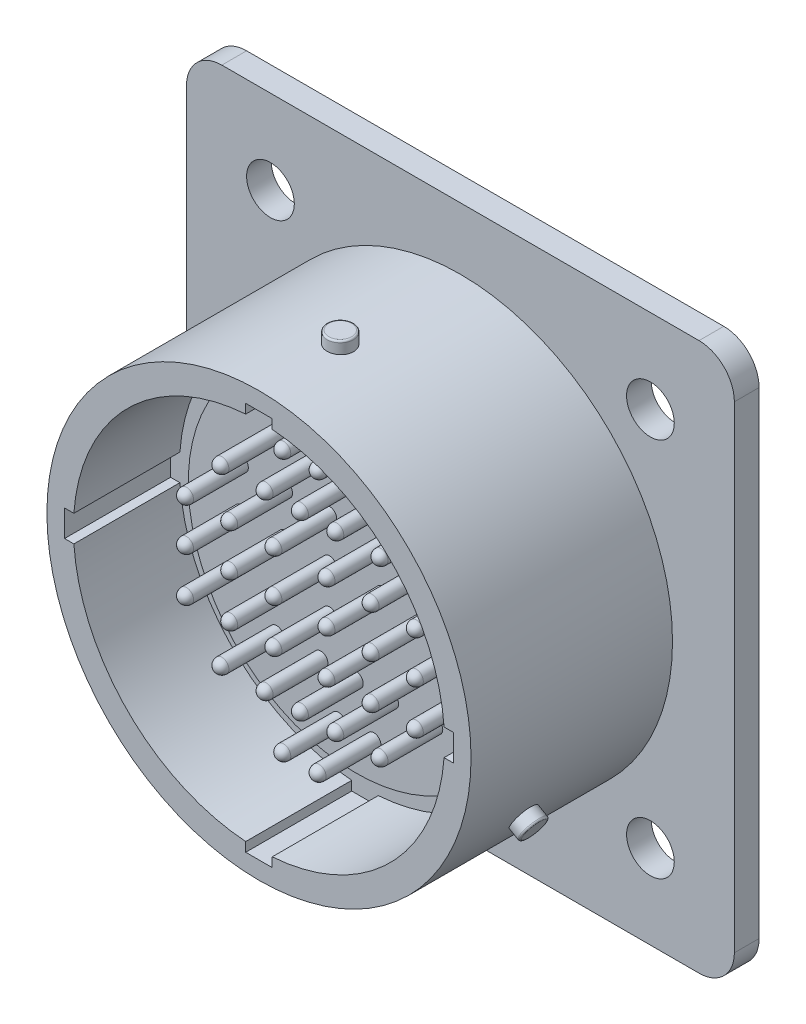
from build123d import *

# Parameters (mm, degrees)
SKETCH_1_W               = 31
SKETCH_1_H               = 31
EXTRUDE_1_DEPTH          = 0.7
SKETCH_2_R               = 1.35
CUT_EXTRUDE_1_DEPTH      = 3.4
SKETCH_4_R               = 11
EXTRUDE_2_DEPTH          = 1.6
SKETCH_5_R               = 12
EXTRUDE_3_DEPTH          = 11.4
FILLET_1_R               = 2
CUT_EXTRUDE_5_DEPTH      = 6
SKETCH_12_R              = 9.5
EXTRUDE_5_DEPTH          = 0.5
SKETCH_13_R              = 0.4
EXTRUDE_6_DEPTH          = 3.5
PATTERN_CIRCULAR_1_COUNT = 3
FILLET_2_R               = 0.4
SKETCH_6_R               = 10
CUT_EXTRUDE_6_DEPTH      = 1.6
EXTRUDE_START            = 3.6
SKETCH_15_R              = 0.4
EXTRUDE_7_DEPTH          = 3.6
CUT_EXTRUDE_7_DEPTH      = 11
SKETCH_17_R              = 0.325
CUT_EXTRUDE_8_DEPTH      = 3


with BuildPart() as part:
    # Эскиз1 → Бобышка-Вытянуть1 (new, symmetric)
    with BuildSketch(Plane.XY):
        Rectangle(SKETCH_1_W, SKETCH_1_H)
    extrude(amount=EXTRUDE_1_DEPTH, both=True)

    # Эскиз2 → Вырез-Вытянуть1 (cut)
    with BuildSketch(Plane.XY.offset(0.7)):
        with Locations((-10.75, 10.75)):
            Circle(SKETCH_2_R)
        with Locations((10.75, 10.75)):
            Circle(SKETCH_2_R)
        with Locations((10.75, -10.75)):
            Circle(SKETCH_2_R)
        with Locations((-10.75, -10.75)):
            Circle(SKETCH_2_R)
    extrude(amount=-CUT_EXTRUDE_1_DEPTH, mode=Mode.SUBTRACT)

    # Эскиз4 → Бобышка-Вытянуть2 (add)
    with BuildSketch(Plane(origin=(0, 0, -0.7), x_dir=(-1, 0, 0), z_dir=(0, 0, -1))):
        with Locations(Location((0, 0, 0), (0, 0, 180))):
            Circle(SKETCH_4_R)
    extrude(amount=EXTRUDE_2_DEPTH)

    # Эскиз5 → Бобышка-Вытянуть3 (add)
    with BuildSketch(Plane.XY.offset(0.7)):
        Circle(SKETCH_5_R)
    extrude(amount=EXTRUDE_3_DEPTH)

    # Скругление1
    fillet_1_edges = [part.edges().sort_by_distance(p)[0] for p in [
        (15.5, -15.5, 0),
        (-15.5, -15.5, 0),
        (-15.5, 15.5, 0),
        (15.5, 15.5, 0),
    ]]
    fillet(fillet_1_edges, radius=FILLET_1_R)

    # Эскиз11 → Вырез-Вытянуть5 (cut)
    with BuildSketch(Plane.XY.offset(12.1)):
        with BuildLine():
            Line((-0.75, 11), (0.75, 11))
            Line((0.75, 11), (0.75, 10.473180033))
            ThreePointArc((0.75, 10.473180033), (7.424621202, 7.424621202), (10.473180033, 0.75))
            Line((10.473180033, 0.75), (11, 0.75))
            Line((11, 0.75), (11, -0.75))
            Line((11, -0.75), (10.473180033, -0.75))
            ThreePointArc((10.473180033, -0.75), (7.424621202, -7.424621202), (0.75, -10.473180033))
            Line((0.75, -10.473180033), (0.75, -11))
            Line((0.75, -11), (-0.75, -11))
            Line((-0.75, -11), (-0.75, -10.473180033))
            ThreePointArc((-0.75, -10.473180033), (-7.424621202, -7.424621202), (-10.473180033, -0.75))
            Line((-10.473180033, -0.75), (-11, -0.75))
            Line((-11, -0.75), (-11, 0.75))
            Line((-11, 0.75), (-10.473180033, 0.75))
            ThreePointArc((-10.473180033, 0.75), (-7.424621202, 7.424621202), (-0.75, 10.473180033))
            Line((-0.75, 10.473180033), (-0.75, 11))
        make_face()
    extrude(amount=-CUT_EXTRUDE_5_DEPTH, mode=Mode.SUBTRACT)

    # Эскиз12 → Бобышка-Вытянуть5 (add)
    with BuildSketch(Plane.XY.offset(6.1)):
        Circle(SKETCH_12_R)
    extrude(amount=EXTRUDE_5_DEPTH)

    # Эскиз13 → Бобышка-Вытянуть6 (add)
    with BuildSketch(Plane.XY.offset(6.6)):
        with Locations((-1.5, 0)):
            Circle(SKETCH_13_R)
        with Locations((-4, 0)):
            Circle(SKETCH_13_R)
        with Locations((-6.5, 0)):
            Circle(SKETCH_13_R)
        with Locations((-1.5, -2.5)):
            Circle(SKETCH_13_R)
        with Locations((-4, -2.5)):
            Circle(SKETCH_13_R)
        with Locations((-6.5, -2.5)):
            Circle(SKETCH_13_R)
        with Locations((-4, 2.414319311)):
            Circle(SKETCH_13_R)
        with Locations((-6.5, 2.414319311)):
            Circle(SKETCH_13_R)
        with Locations((-1.5, 2.414319311)):
            Circle(SKETCH_13_R)
        with Locations((0, 4.914319311)):
            Circle(SKETCH_13_R)
        with Locations((-2, 4.914319311)):
            Circle(SKETCH_13_R)
        with Locations((-4.5, 4.914319311)):
            Circle(SKETCH_13_R)
        with Locations((-1, 7.414319311)):
            Circle(SKETCH_13_R)
        with Locations(Location((-2, -4.914319311, 0), (0, 0, 180))):
            Circle(SKETCH_13_R)
        with Locations(Location((-1, -7.414319311, 0), (0, 0, 180))):
            Circle(SKETCH_13_R)
        with Locations(Location((0, -4.914319311, 0), (0, 0, 180))):
            Circle(SKETCH_13_R)
        with Locations(Location((-4.5, -4.914319311, 0), (0, 0, 180))):
            Circle(SKETCH_13_R)
        with Locations((4.5, -4.914319311)):
            Circle(SKETCH_13_R)
        with Locations((1, -7.414319311)):
            Circle(SKETCH_13_R)
        with Locations((2, -4.914319311)):
            Circle(SKETCH_13_R)
        with Locations(Location((1, 7.414319311, 0), (0, 0, 180))):
            Circle(SKETCH_13_R)
        with Locations(Location((4.5, 4.914319311, 0), (0, 0, 180))):
            Circle(SKETCH_13_R)
        with Locations(Location((2, 4.914319311, 0), (0, 0, 180))):
            Circle(SKETCH_13_R)
        with Locations(Location((1.5, 2.414319311, 0), (0, 0, 180))):
            Circle(SKETCH_13_R)
        with Locations(Location((6.5, 2.414319311, 0), (0, 0, 180))):
            Circle(SKETCH_13_R)
        with Locations(Location((4, 2.414319311, 0), (0, 0, 180))):
            Circle(SKETCH_13_R)
        with Locations(Location((6.5, -2.5, 0), (0, 0, 180))):
            Circle(SKETCH_13_R)
        with Locations(Location((4, -2.5, 0), (0, 0, 180))):
            Circle(SKETCH_13_R)
        with Locations(Location((1.5, -2.5, 0), (0, 0, 180))):
            Circle(SKETCH_13_R)
        with Locations(Location((6.5, 0, 0), (0, 0, 180))):
            Circle(SKETCH_13_R)
        with Locations(Location((4, 0, 0), (0, 0, 180))):
            Circle(SKETCH_13_R)
        with Locations(Location((1.5, 0, 0), (0, 0, 180))):
            Circle(SKETCH_13_R)
    extrude(amount=EXTRUDE_6_DEPTH)

    # Эскиз14 → Повернуть1 (revolve)
    with BuildSketch(Plane.XY.offset(7.5), mode=Mode.PRIVATE) as revolve_1_sk:
        with BuildLine():
            Line((0, 12.668613329), (0.65, 12.668613329))
            ThreePointArc((0.65, 12.668613329), (0.720710678, 12.639324007), (0.75, 12.568613329))
            Line((0.75, 12.568613329), (0.75, 11.868613329))
            Line((0.75, 11.868613329), (0, 11.868613329))
            Line((0, 11.868613329), (0, 12.668613329))
        make_face()
    revolve_1 = revolve(revolve_1_sk.sketch.rotate(Axis((0, 12.826415176, 7.5), (0, -1, 0)), 90), axis=Axis((0, 12.826415176, 7.5), (0, -1, 0)))

    # Круговой массив1: Повернуть1 ×3 about axis
    pattern_circular_1_axis = Axis((0, 0, 0), (0, 0, 1))
    for i in range(1, PATTERN_CIRCULAR_1_COUNT):
        add(revolve_1.rotate(pattern_circular_1_axis, i * 360 / PATTERN_CIRCULAR_1_COUNT))

    # Скругление2
    fillet_2_edges = [part.edges().sort_by_distance(p)[0] for p in [
        (-1.9, 0, 10.1),
        (-1.9, -2.5, 10.1),
        (-4.4, -2.5, 10.1),
        (-4.4, 0, 10.1),
        (-6.9, 0, 10.1),
        (-6.9, -2.5, 10.1),
        (-1.9, 2.414319311, 10.1),
        (-4.4, 2.414319311, 10.1),
        (-6.9, 2.414319311, 10.1),
        (-0.4, 4.914319311, 10.1),
        (-2.4, 4.914319311, 10.1),
        (-4.9, 4.914319311, 10.1),
        (-1.4, 7.414319311, 10.1),
        (-1.6, -4.914319311, 10.1),
        (-0.6, -7.414319311, 10.1),
        (0.4, -4.914319311, 10.1),
        (-4.1, -4.914319311, 10.1),
        (4.1, -4.914319311, 10.1),
        (0.6, -7.414319311, 10.1),
        (1.6, -4.914319311, 10.1),
        (1.4, 7.414319311, 10.1),
        (4.9, 4.914319311, 10.1),
        (2.4, 4.914319311, 10.1),
        (1.9, 2.414319311, 10.1),
        (6.9, 2.414319311, 10.1),
        (4.4, 2.414319311, 10.1),
        (6.9, -2.5, 10.1),
        (4.4, -2.5, 10.1),
        (1.9, -2.5, 10.1),
        (6.9, 0, 10.1),
        (4.4, 0, 10.1),
        (1.9, 0, 10.1),
    ]]
    fillet(fillet_2_edges, radius=FILLET_2_R)

    # Эскиз6 → Вырез-Вытянуть6 (cut)
    with BuildSketch(Plane(origin=(0, 0, -2.3), x_dir=(-1, 0, 0), z_dir=(0, 0, -1))):
        Circle(SKETCH_6_R)
    extrude(amount=-CUT_EXTRUDE_6_DEPTH, mode=Mode.SUBTRACT)

    # Эскиз15 → Бобышка-Вытянуть7 (add)
    with BuildSketch(Plane(origin=(0, 0, -0.7), x_dir=(-1, 0, 0), z_dir=(0, 0, -1)).offset(EXTRUDE_START)):
        with Locations((1, 7.414319311)):
            Circle(SKETCH_15_R)
        with Locations((-1, 7.414319311)):
            Circle(SKETCH_15_R)
        with Locations((4.5, 4.914319311)):
            Circle(SKETCH_15_R)
        with Locations((2, 4.914319311)):
            Circle(SKETCH_15_R)
        with Locations((0, 4.914319311)):
            Circle(SKETCH_15_R)
        with Locations((6.5, 2.414319311)):
            Circle(SKETCH_15_R)
        with Locations((4, 2.414319311)):
            Circle(SKETCH_15_R)
        with Locations((1.5, 2.414319311)):
            Circle(SKETCH_15_R)
        with Locations((-1.5, 2.414319311)):
            Circle(SKETCH_15_R)
        with Locations((-4, 2.414319311)):
            Circle(SKETCH_15_R)
        with Locations((-6.5, 2.414319311)):
            Circle(SKETCH_15_R)
        with Locations((-4.5, 4.914319311)):
            Circle(SKETCH_15_R)
        with Locations((-2, 4.914319311)):
            Circle(SKETCH_15_R)
        with Locations((6.5, 0)):
            Circle(SKETCH_15_R)
        with Locations((4, 0)):
            Circle(SKETCH_15_R)
        with Locations((1.5, 0)):
            Circle(SKETCH_15_R)
        with Locations((-1.5, 0)):
            Circle(SKETCH_15_R)
        with Locations((-4, 0)):
            Circle(SKETCH_15_R)
        with Locations((-6.5, 0)):
            Circle(SKETCH_15_R)
        with Locations((6.5, -2.5)):
            Circle(SKETCH_15_R)
        with Locations((4, -2.5)):
            Circle(SKETCH_15_R)
        with Locations((1.5, -2.5)):
            Circle(SKETCH_15_R)
        with Locations((-1.5, -2.5)):
            Circle(SKETCH_15_R)
        with Locations((-4, -2.5)):
            Circle(SKETCH_15_R)
        with Locations((-6.5, -2.5)):
            Circle(SKETCH_15_R)
        with Locations((-4.5, -4.914319311)):
            Circle(SKETCH_15_R)
        with Locations((-2, -4.914319311)):
            Circle(SKETCH_15_R)
        with Locations((0, -4.914319311)):
            Circle(SKETCH_15_R)
        with Locations((2, -4.914319311)):
            Circle(SKETCH_15_R)
        with Locations((4.5, -4.914319311)):
            Circle(SKETCH_15_R)
        with Locations((1, -7.414319311)):
            Circle(SKETCH_15_R)
        with Locations((-1, -7.414319311)):
            Circle(SKETCH_15_R)
    extrude(amount=-EXTRUDE_7_DEPTH)

    # Эскиз16 → Вырез-Вытянуть7 (cut, symmetric)
    with BuildSketch(Plane(origin=(0, 0, 0), x_dir=(0, 0, -1), z_dir=(1, 0, 0))):
        with BuildLine():
            Line((4.3, 7.814319311), (2.8, 7.814319311))
            ThreePointArc((2.8, 7.814319311), (3.523678221, 7.51561264), (4.3, 7.414319311))
            Line((4.3, 7.414319311), (4.3, 7.814319311))
        make_face()
        with BuildLine():
            Line((4.3, 5.314319311), (4.3, 4.914319311))
            ThreePointArc((4.3, 4.914319311), (3.523678221, 5.01561264), (2.8, 5.314319311))
            Line((2.8, 5.314319311), (4.3, 5.314319311))
        make_face()
        with BuildLine():
            Line((4.3, 2.814319311), (4.3, 2.414319311))
            ThreePointArc((4.3, 2.414319311), (3.523678221, 2.51561264), (2.8, 2.814319311))
            Line((2.8, 2.814319311), (4.3, 2.814319311))
        make_face()
        with BuildLine():
            Line((4.3, 0.4), (4.3, 0))
            ThreePointArc((4.3, 0), (3.523678221, 0.101293329), (2.8, 0.4))
            Line((2.8, 0.4), (4.3, 0.4))
        make_face()
        with BuildLine():
            Line((4.3, -2.1), (4.3, -2.5))
            ThreePointArc((4.3, -2.5), (3.523678221, -2.398706671), (2.8, -2.1))
            Line((2.8, -2.1), (4.3, -2.1))
        make_face()
        with BuildLine():
            Line((4.3, -4.514319311), (2.8, -4.514319311))
            ThreePointArc((2.8, -4.514319311), (3.523678221, -4.813025983), (4.3, -4.914319311))
            Line((4.3, -4.914319311), (4.3, -4.514319311))
        make_face()
        with BuildLine():
            Line((4.3, -7.014319311), (4.3, -7.414319311))
            ThreePointArc((4.3, -7.414319311), (3.523678221, -7.313025983), (2.8, -7.014319311))
            Line((2.8, -7.014319311), (4.3, -7.014319311))
        make_face()
    extrude(amount=CUT_EXTRUDE_7_DEPTH, both=True, mode=Mode.SUBTRACT)

    # Эскиз17 → Вырез-Вытянуть8 (cut)
    with BuildSketch(Plane(origin=(0, 0, -4.3), x_dir=(-1, 0, 0), z_dir=(0, 0, -1))):
        with Locations((-1, 7.414319311)):
            Circle(SKETCH_17_R)
        with Locations((1, 7.414319311)):
            Circle(SKETCH_17_R)
        with Locations((-4.5, 4.914319311)):
            Circle(SKETCH_17_R)
        with Locations((-2, 4.914319311)):
            Circle(SKETCH_17_R)
        with Locations((0, 4.914319311)):
            Circle(SKETCH_17_R)
        with Locations((2, 4.914319311)):
            Circle(SKETCH_17_R)
        with Locations((4.5, 4.914319311)):
            Circle(SKETCH_17_R)
        with Locations((-6.5, 0)):
            Circle(SKETCH_17_R)
        with Locations((-4, 0)):
            Circle(SKETCH_17_R)
        with Locations((-1.5, 0)):
            Circle(SKETCH_17_R)
        with Locations((1.5, 0)):
            Circle(SKETCH_17_R)
        with Locations((4, 0)):
            Circle(SKETCH_17_R)
        with Locations((6.5, 0)):
            Circle(SKETCH_17_R)
        with Locations((-6.5, -2.5)):
            Circle(SKETCH_17_R)
        with Locations((-4, -2.5)):
            Circle(SKETCH_17_R)
        with Locations((-1.5, -2.5)):
            Circle(SKETCH_17_R)
        with Locations((-4.5, -4.914319311)):
            Circle(SKETCH_17_R)
        with Locations((-2, -4.914319311)):
            Circle(SKETCH_17_R)
        with Locations((0, -4.914319311)):
            Circle(SKETCH_17_R)
        with Locations((-1, -7.414319311)):
            Circle(SKETCH_17_R)
        with Locations((1, -7.414319311)):
            Circle(SKETCH_17_R)
        with Locations((2, -4.914319311)):
            Circle(SKETCH_17_R)
        with Locations((4.5, -4.914319311)):
            Circle(SKETCH_17_R)
        with Locations((1.5, -2.5)):
            Circle(SKETCH_17_R)
        with Locations((4, -2.5)):
            Circle(SKETCH_17_R)
        with Locations((6.5, -2.5)):
            Circle(SKETCH_17_R)
        with Locations((-6.5, 2.414319311)):
            Circle(SKETCH_17_R)
        with Locations((-4, 2.414319311)):
            Circle(SKETCH_17_R)
        with Locations((-1.5, 2.414319311)):
            Circle(SKETCH_17_R)
        with Locations((1.5, 2.414319311)):
            Circle(SKETCH_17_R)
        with Locations((4, 2.414319311)):
            Circle(SKETCH_17_R)
        with Locations((6.5, 2.414319311)):
            Circle(SKETCH_17_R)
    extrude(amount=-CUT_EXTRUDE_8_DEPTH, mode=Mode.SUBTRACT)


solid = part.part
